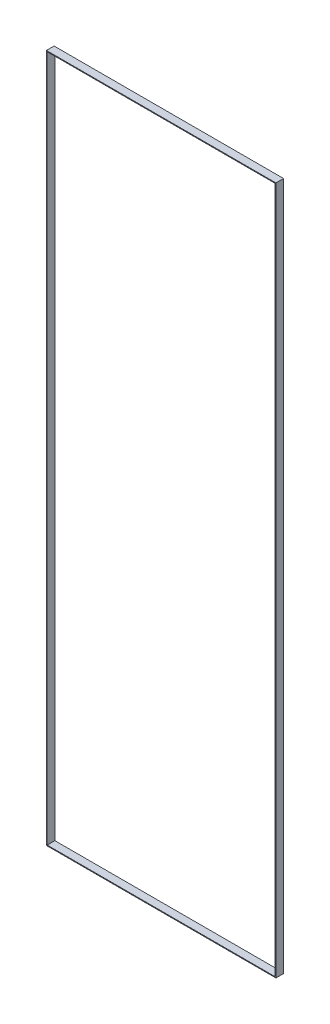
from build123d import *

# Parameters (mm, degrees)
SKETCH1_W           = 600
SKETCH1_H           = 1800
SKETCH1_W_2         = 596
SKETCH1_H_2         = 1796
BOSS_EXTRUDE1_DEPTH = 20


with BuildPart() as part:
    # Sketch1 → Boss-Extrude1 (new body)
    with BuildSketch(Plane.XY):
        Rectangle(SKETCH1_W, SKETCH1_H)
        Rectangle(SKETCH1_W_2, SKETCH1_H_2, mode=Mode.SUBTRACT)
    extrude(amount=BOSS_EXTRUDE1_DEPTH)


solid = part.part
